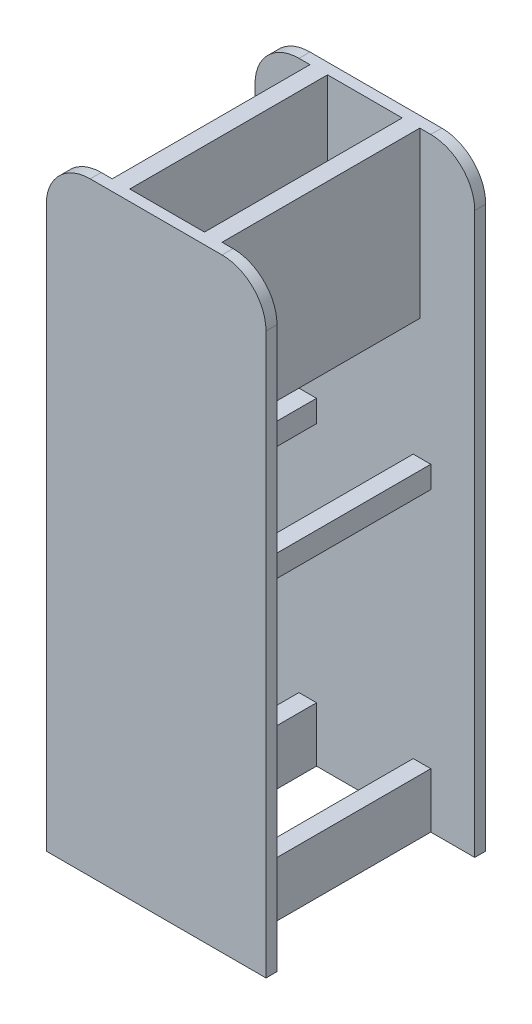
from build123d import *

# Parameters (mm, degrees)
SKETCH_1_W      = 200
SKETCH_1_H      = 550
EXTRUDE_2_DEPTH = 10
FILLET_2_R      = 40
SKETCH_2_W      = 16
SKETCH_2_H      = 50
SKETCH_2_H_2    = 20
SKETCH_2_H_3    = 150
EXTRUDE_4_DEPTH = 90
SKETCH_3_W      = 200
SKETCH_3_H      = 550
EXTRUDE_5_DEPTH = 10
FILLET_5_R      = 40


with BuildPart() as part:
    # 스케치1 → 보스-돌출2 (new body)
    with BuildSketch(Plane.XY):
        with Locations((100, 275)):
            Rectangle(SKETCH_1_W, SKETCH_1_H)
    extrude(amount=EXTRUDE_2_DEPTH)

    # 필렛2
    fillet_2_edges = [part.edges().sort_by_distance(p)[0] for p in [
        (0, 550, 5),
        (200, 550, 5),
    ]]
    fillet(fillet_2_edges, radius=FILLET_2_R)

    # 스케치2 → 보스-돌출4 (add)
    with BuildSketch(Plane.XY.offset(10)):
        with Locations((152, 25)):
            Rectangle(SKETCH_2_W, SKETCH_2_H)
        with Locations((152, 280)):
            Rectangle(SKETCH_2_W, SKETCH_2_H_2)
        with Locations((142, 475)):
            Rectangle(SKETCH_2_W, SKETCH_2_H_3)
        with Locations((48, 25)):
            Rectangle(SKETCH_2_W, SKETCH_2_H)
        with Locations((48, 280)):
            Rectangle(SKETCH_2_W, SKETCH_2_H_2)
        with Locations((58, 475)):
            Rectangle(SKETCH_2_W, SKETCH_2_H_3)
    extrude_4 = extrude(amount=EXTRUDE_4_DEPTH)

    # 대칭 복사26: 보스-돌출4 across plane
    add(extrude_4.mirror(Plane(origin=(0, 0, 100), x_dir=(1, 0, 0), z_dir=(0, 0, -1))))

    # 스케치3 → 보스-돌출5 (add)
    with BuildSketch(Plane.XY.offset(190)):
        with Locations((100, 275)):
            Rectangle(SKETCH_3_W, SKETCH_3_H)
    extrude(amount=EXTRUDE_5_DEPTH)

    # 필렛5
    fillet_5_edges = [part.edges().sort_by_distance(p)[0] for p in [
        (0, 550, 195),
        (200, 550, 195),
    ]]
    fillet(fillet_5_edges, radius=FILLET_5_R)


solid = part.part
